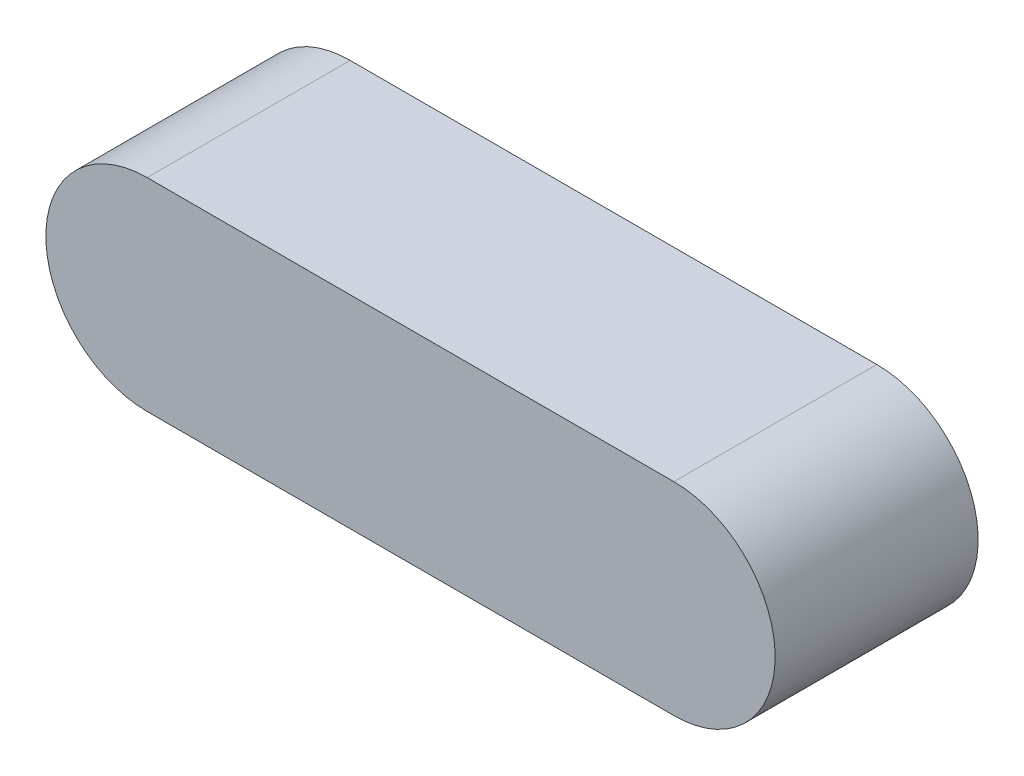
from build123d import *

# Parameters (mm, degrees)
EXTRUDE_1_DEPTH     = 25.05
SKETCH_2_R          = 1.5
CUT_EXTRUDE_1_DEPTH = 3


with BuildPart() as part:
    # 草图1 → 凸台-拉伸1 (new body)
    with BuildSketch(Plane.XY):
        with BuildLine():
            Line((-32.5, 12.5), (32.5, 12.5))
            ThreePointArc((32.5, 12.5), (45, 0), (32.5, -12.5))
            Line((32.5, -12.5), (-32.5, -12.5))
            ThreePointArc((-32.5, -12.5), (-45, 0), (-32.5, 12.5))
        make_face()
    extrude(amount=EXTRUDE_1_DEPTH)

    # 草图2 → 切除-拉伸1 (cut)
    with BuildSketch(Plane(origin=(0, 0, 0), x_dir=(-1, 0, 0), z_dir=(0, 0, -1))):
        with Locations((-22.5, 0)):
            Circle(SKETCH_2_R)
        with Locations((22.5, 0)):
            Circle(SKETCH_2_R)
    extrude(amount=-CUT_EXTRUDE_1_DEPTH, mode=Mode.SUBTRACT)


solid = part.part
